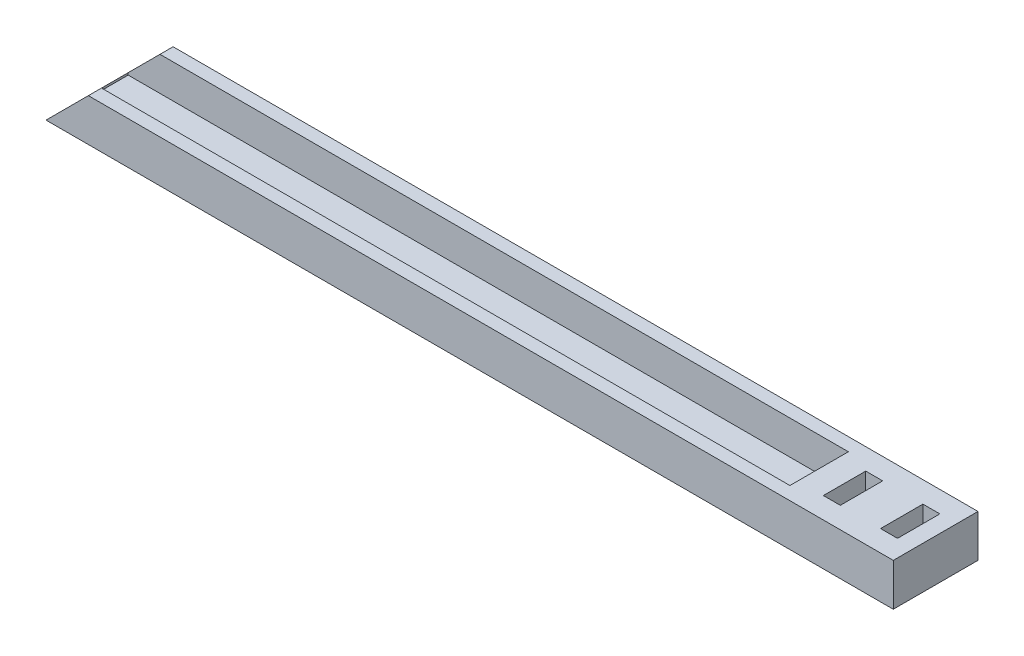
from build123d import *

# Parameters (mm, degrees)
SKETCH1_W          = 254
SKETCH1_H          = 25.4
BASE_EXTRUDE_DEPTH = 12.7
SKETCH3_W          = 215.9
SKETCH3_H          = 17.526
PIECE_CUT_DEPTH    = 10.16
CORNER_CUT_DEPTH   = 256.582569828
SKETCH6_W          = 5.08
SKETCH6_H          = 12.7
PEG_CUT_DEPTH      = 10.16


with BuildPart() as part:
    # Sketch1 → Base Extrude (new body)
    with BuildSketch(Plane(origin=(0, 0, 0), x_dir=(1, 0, 0), z_dir=(0, 1, 0))):
        with Locations((127, 12.7)):
            Rectangle(SKETCH1_W, SKETCH1_H)
    extrude(amount=BASE_EXTRUDE_DEPTH)

    # Sketch3 → Piece Cut (cut)
    with BuildSketch(Plane(origin=(0, 12.7, 0), x_dir=(1, 0, 0), z_dir=(0, 1, 0))):
        with Locations((111.125, 12.7)):
            Rectangle(SKETCH3_W, SKETCH3_H)
    extrude(amount=-PIECE_CUT_DEPTH, mode=Mode.SUBTRACT)

    # Sketch4 → Corner Cut (cut, through all)
    with BuildSketch(Plane(origin=(0, 0, -25.4), x_dir=(-1, 0, 0), z_dir=(0, 0, -1))):
        Polygon((0, 0), (-12.7, 12.7), (0, 12.7), align=None)
    extrude(amount=-CORNER_CUT_DEPTH, mode=Mode.SUBTRACT)

    # Sketch6 → Peg Cut (cut)
    with BuildSketch(Plane(origin=(0, 12.7, 0), x_dir=(1, 0, 0), z_dir=(0, 1, 0))):
        with Locations((229.235, 12.7)):
            Rectangle(SKETCH6_W, SKETCH6_H)
        with Locations((246.38, 12.7)):
            Rectangle(SKETCH6_W, SKETCH6_H)
    extrude(amount=-PEG_CUT_DEPTH, mode=Mode.SUBTRACT)


solid = part.part
